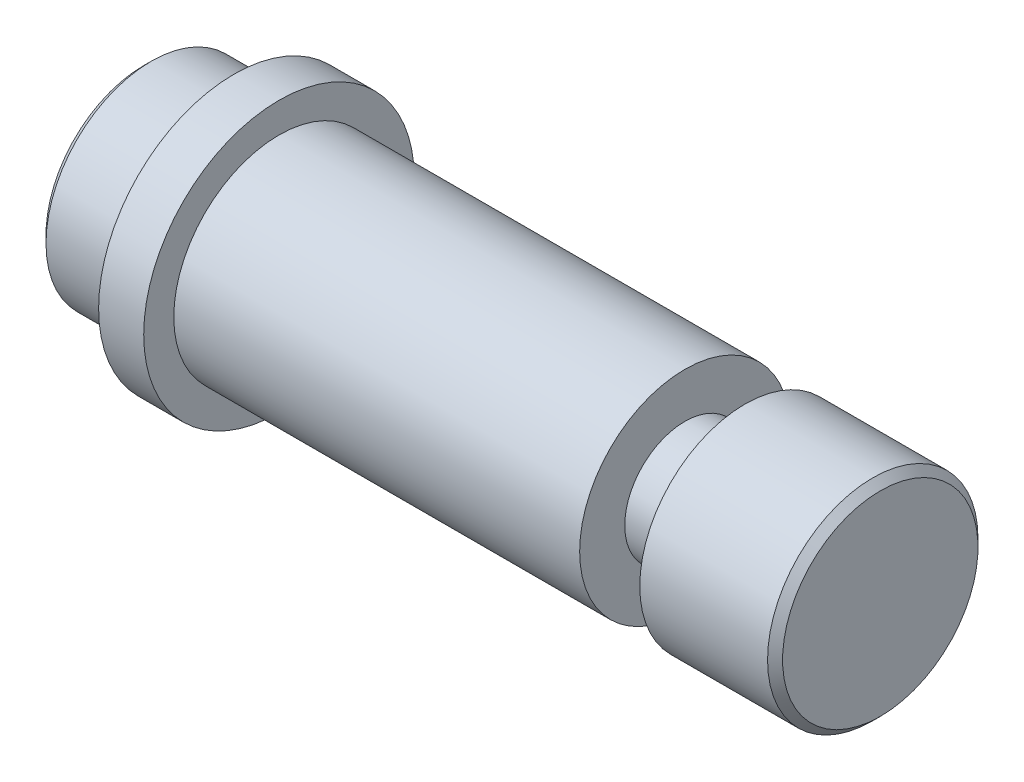
from build123d import *

# Parameters (mm, degrees)
CHAMFER_1_SIZE = 0.5


with BuildPart() as part:
    # 草图1 → 旋转1 (revolve)
    with BuildSketch(Plane.XY):
        Polygon((-18.398826979, 0), (-18.398826979, 7), (-12.398826979, 7), (-12.398826979, 9), (-9.398826979, 9), (-9.398826979, 7), (17.601173021, 7), (17.601173021, 4), (21.601173021, 4), (21.601173021, 7), (30.601173021, 7), (30.601173021, 0), align=None)
    revolve(axis=Axis((30.601173021, 0, 0), (-1, 0, 0)))

    # 倒角1
    chamfer_1_edges = [part.edges().sort_by_distance(p)[0] for p in [
        (-18.398826979, -7, 0),
        (30.601173021, -7, 0),
    ]]
    chamfer(chamfer_1_edges, length=CHAMFER_1_SIZE)


solid = part.part
